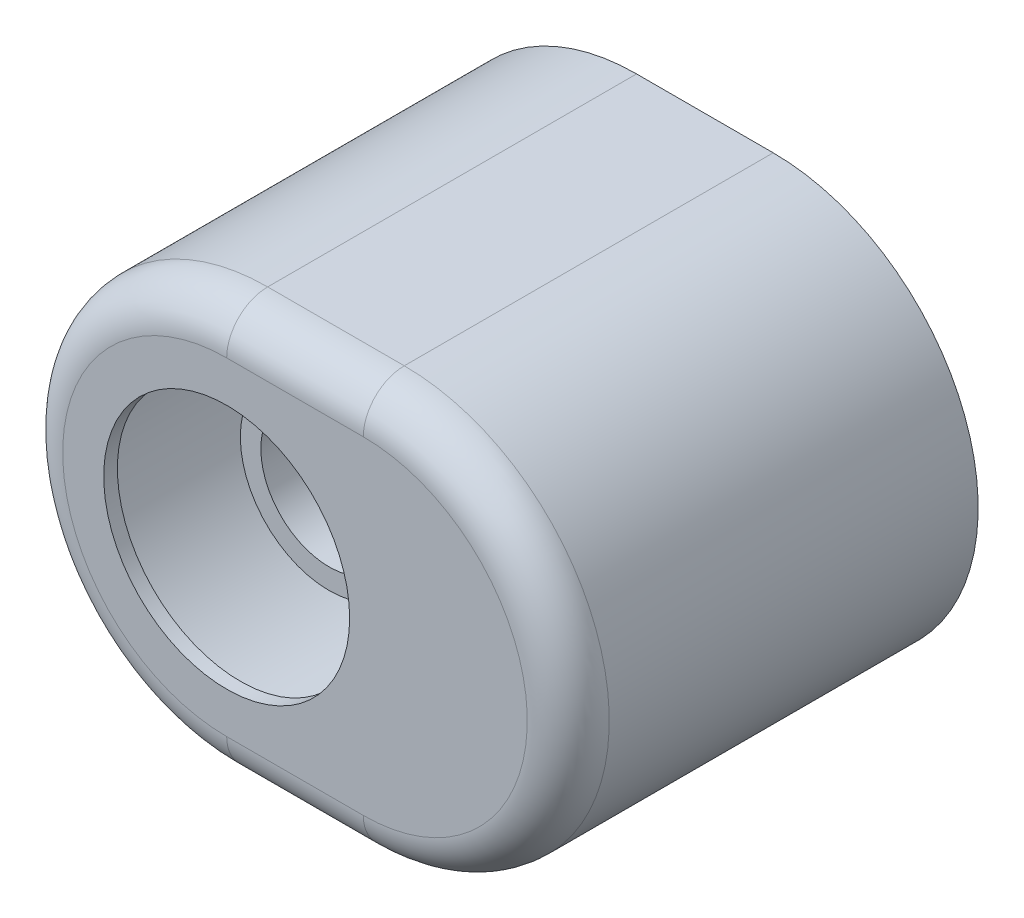
from build123d import *

# Parameters (mm, degrees)
EXTRUDE_1_DEPTH     = 60
FILLET_1_R          = 6
SHELL_1_T           = -2
SKETCH_3_R          = 18
CUT_EXTRUDE_1_DEPTH = 79.102496759


with BuildPart() as part:
    # 草图2 → 凸台-拉伸1 (new body)
    with BuildSketch(Plane.XY):
        with BuildLine():
            Line((-10, 30), (10, 30))
            ThreePointArc((10, 30), (40, 0), (10, -30))
            Line((10, -30), (-10, -30))
            ThreePointArc((-10, -30), (-40, 0), (-10, 30))
        make_face()
    extrude(amount=EXTRUDE_1_DEPTH)

    # 圆角1
    fillet_1_edges = [part.edges().sort_by_distance(p)[0] for p in [
        (40, 0, 60),
        (0, 30, 60),
        (-40, 0, 60),
        (0, -30, 60),
    ]]
    fillet(fillet_1_edges, radius=FILLET_1_R)

    # 抽壳1
    shell_1_openings = [part.faces().sort_by_distance(p)[0] for p in [
        (0, 0, 0),
    ]]
    offset(amount=SHELL_1_T, openings=shell_1_openings, kind=Kind.INTERSECTION)

    # 草图3 → 切除-拉伸1 (cut, through all)
    with BuildSketch(Plane.XY.offset(60)):
        with Locations((-10, 0)):
            Circle(SKETCH_3_R)
    extrude(amount=-CUT_EXTRUDE_1_DEPTH, mode=Mode.SUBTRACT)


with BuildPart() as body_2:
    # 草图4 → 旋转1 (revolve)
    with BuildSketch(Plane(origin=(0, 0, 0), x_dir=(1, 0, 0), z_dir=(0, 1, 0))):
        Polygon((-20, -45), (-20, -39), (-18, -39), (-18, -37), (-14.5, -31), (-14.5, -29), (-16.5, -29), (-16.5, -25), (-19.5, -25), (-19.5, -31.632889149), (-23, -37.632889149), (-23, -45), align=None)
    revolve(axis=Axis((-10, 0, 0), (0, 0, 1)))


solid = Compound([part.part, body_2.part])
